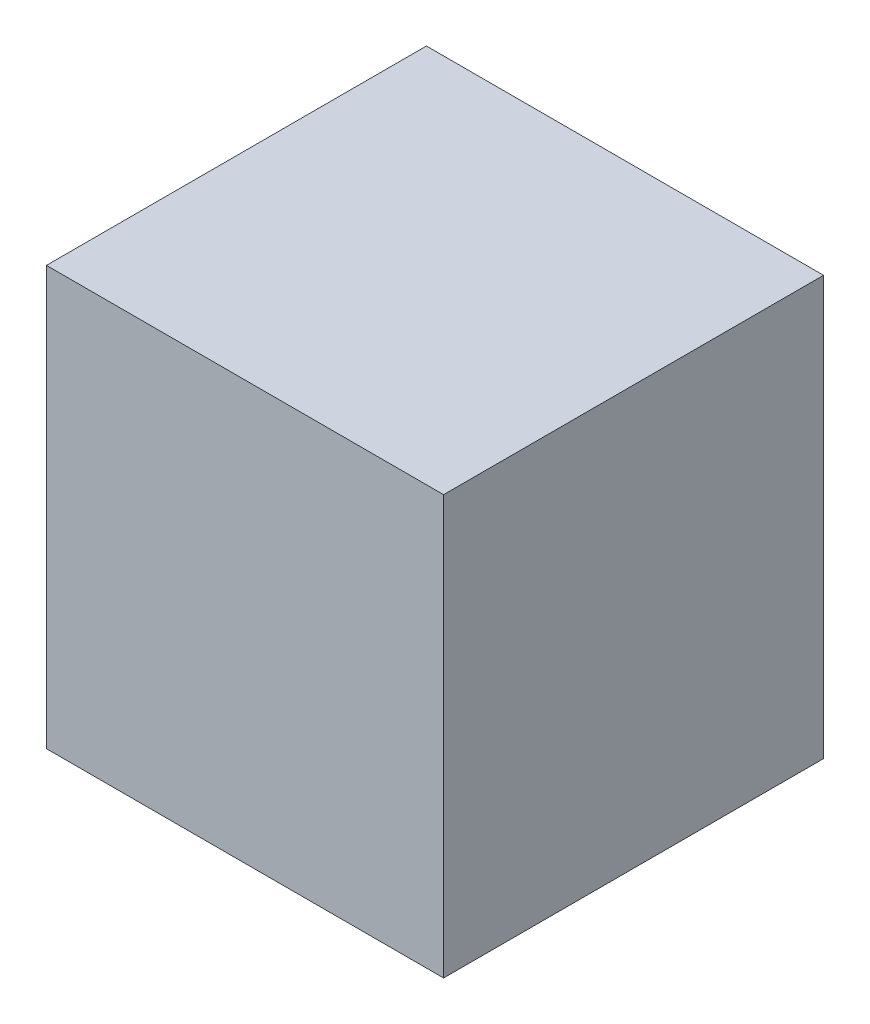
from build123d import *

# Parameters (mm, degrees)
SKETCH1_W           = 469.9
SKETCH1_H           = 449.58
BOSS_EXTRUDE1_DEPTH = 495.3


with BuildPart() as part:
    # Sketch1 → Boss-Extrude1 (new body)
    with BuildSketch(Plane(origin=(0, 0, 0), x_dir=(1, 0, 0), z_dir=(0, 1, 0))):
        Rectangle(SKETCH1_W, SKETCH1_H)
    extrude(amount=BOSS_EXTRUDE1_DEPTH)


solid = part.part
